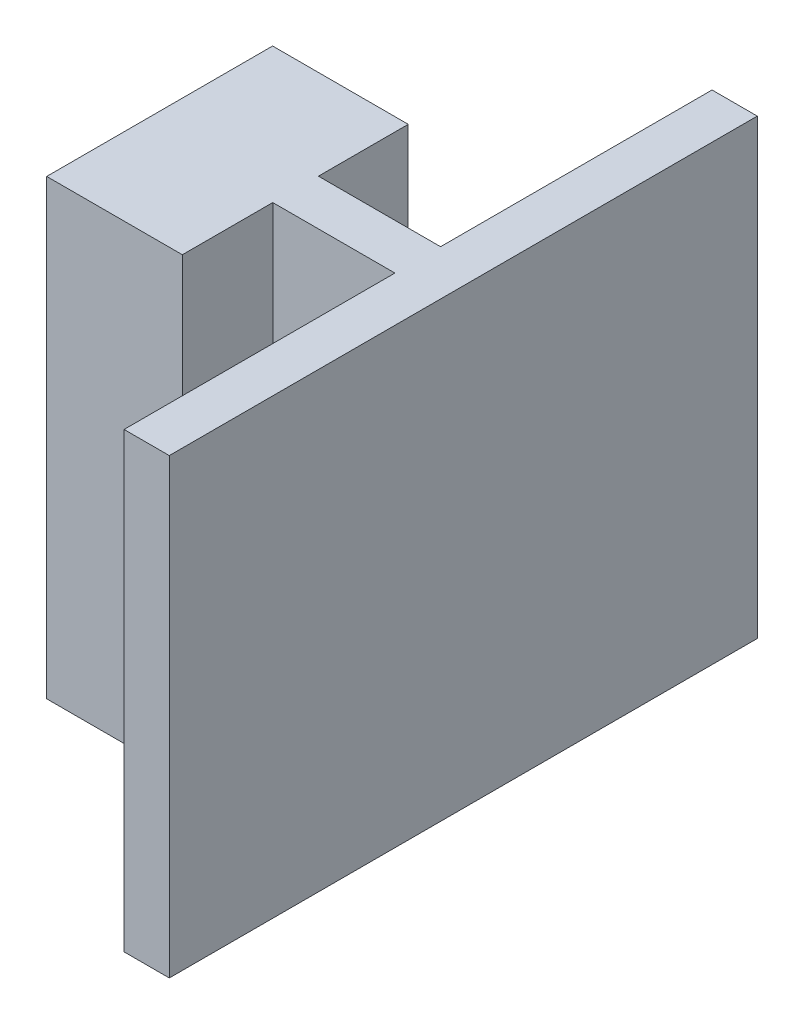
from build123d import *

# Parameters (mm, degrees)
BOSS_EXTRUDE1_DEPTH = 127


with BuildPart() as part:
    # Sketch1 → Boss-Extrude1 (new body)
    with BuildSketch(Plane(origin=(0, 0, 0), x_dir=(1, 0, 0), z_dir=(0, 1, 0))):
        Polygon((34.29, -12.815454545), (0, -12.815454545), (0, -38.195134545), (-38.0746, -38.195134545), (-38.0746, 25.213425455), (0, 25.213425455), (0, 0), (34.29, 0), (34.29, 76.2), (46.99, 76.2), (46.99, -88.8492), (34.29, -88.8492), align=None)
    extrude(amount=BOSS_EXTRUDE1_DEPTH)


solid = part.part
